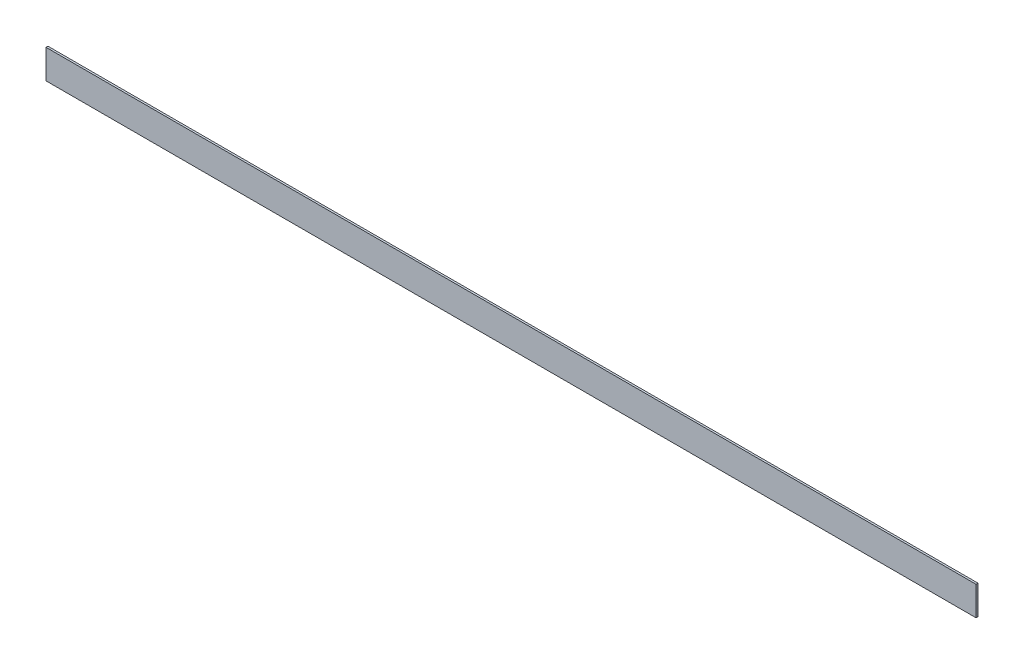
from build123d import *

# Parameters (mm, degrees)
SKETCH1_W           = 609.6
SKETCH1_H           = 19.05
BOSS_EXTRUDE1_DEPTH = 1.27


with BuildPart() as part:
    # Sketch1 → Boss-Extrude1 (new body)
    with BuildSketch(Plane.XY):
        with Locations((304.8, 9.525)):
            Rectangle(SKETCH1_W, SKETCH1_H)
    extrude(amount=BOSS_EXTRUDE1_DEPTH)


solid = part.part
